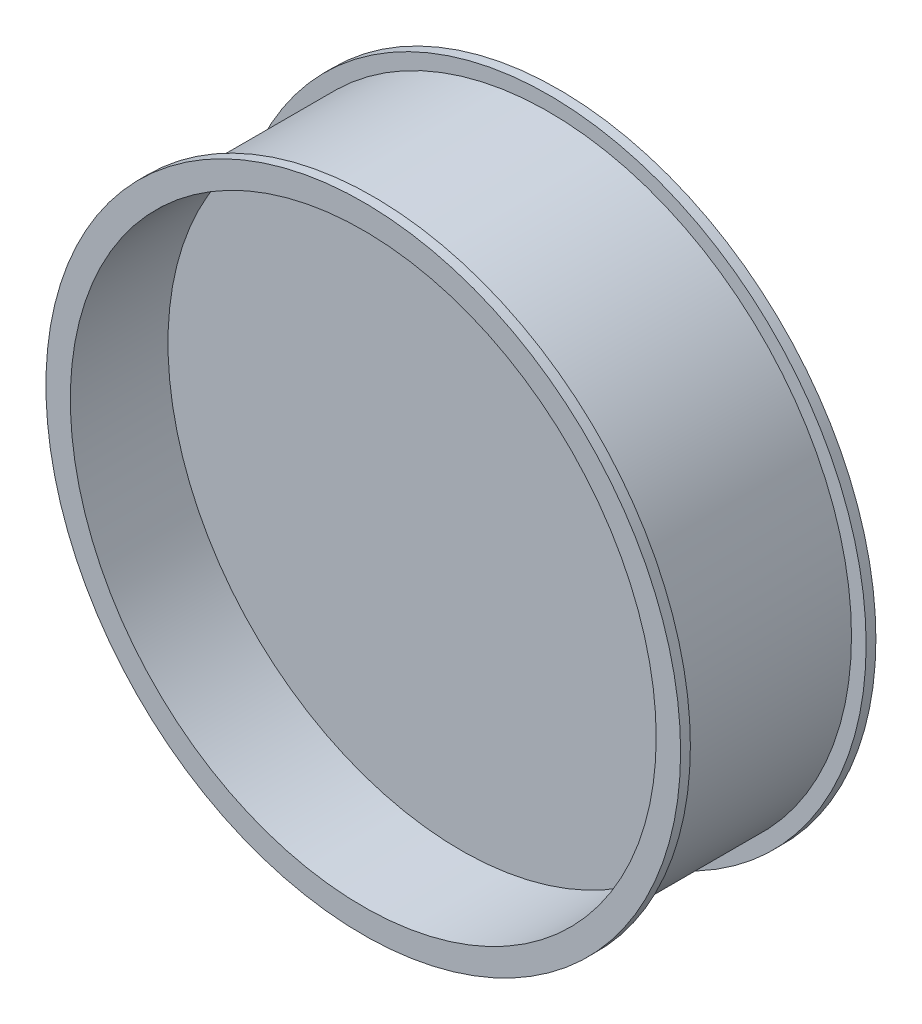
from build123d import *

# Parameters (mm, degrees)
ESQUISSE1_R             = 32.5
BOSS_EXTRU_1_DEPTH      = 1
ESQUISSE2_R             = 31
BOSS_EXTRU_2_DEPTH      = 18
ESQUISSE3_R             = 32.5
BOSS_EXTRU_3_DEPTH      = 1
ESQUISSE4_R             = 30
ENL_V_MAT_EXTRU_1_DEPTH = 10


with BuildPart() as part:
    # Esquisse1 → Boss.-Extru.1 (new body)
    with BuildSketch(Plane.XY):
        Circle(ESQUISSE1_R)
    extrude(amount=BOSS_EXTRU_1_DEPTH)

    # Esquisse2 → Boss.-Extru.2 (add)
    with BuildSketch(Plane.XY.offset(1)):
        Circle(ESQUISSE2_R)
    extrude(amount=BOSS_EXTRU_2_DEPTH)

    # Esquisse3 → Boss.-Extru.3 (add)
    with BuildSketch(Plane.XY.offset(19)):
        Circle(ESQUISSE3_R)
    extrude(amount=BOSS_EXTRU_3_DEPTH)

    # Esquisse4 → Enlèv. mat.-Extru.1 (cut)
    with BuildSketch(Plane.XY.offset(20)):
        Circle(ESQUISSE4_R)
    extrude(amount=-ENL_V_MAT_EXTRU_1_DEPTH, mode=Mode.SUBTRACT)


solid = part.part
